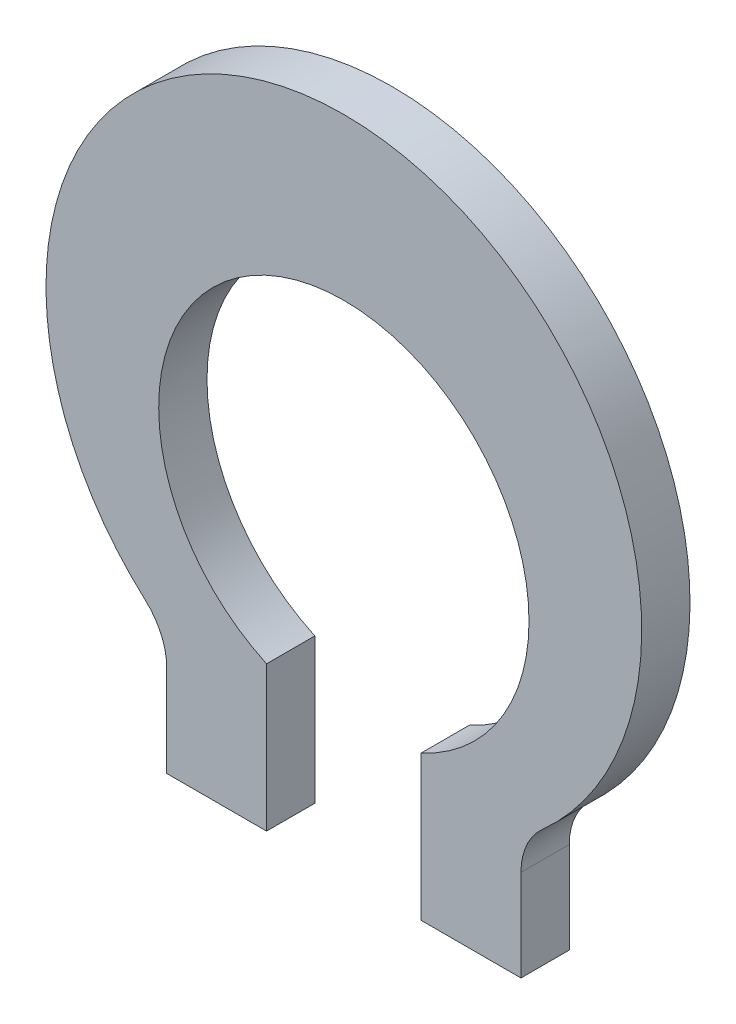
from build123d import *

# Parameters (mm, degrees)
BOSS_EXTRUDE1_DEPTH = 1.5
FILLET1_R           = 2


with BuildPart() as part:
    # Sketch1 → Boss-Extrude1 (new body)
    with BuildSketch(Plane.XY):
        with BuildLine():
            ThreePointArc((2.4, 4.5), (0, 15.475179423), (-2.4, 4.5))
            Line((-2.4, 4.5), (-2.4, 0))
            Line((-2.4, 0), (-5.5, 0))
            Line((-5.5, 0), (-5.5, 3.787942032))
            ThreePointArc((-5.5, 3.787942032), (0, 20.475179423), (5.5, 3.787942032))
            Line((5.5, 3.787942032), (5.5, 0))
            Line((5.5, 0), (2.4, 0))
            Line((2.4, 0), (2.4, 4.5))
        make_face()
    extrude(amount=BOSS_EXTRUDE1_DEPTH)

    # Fillet1
    fillet1_edges = [part.edges().sort_by_distance(p)[0] for p in [
        (-5.5, 3.787942032, 0.75),
        (5.5, 3.787942032, 0.75),
    ]]
    fillet(fillet1_edges, radius=FILLET1_R)


solid = part.part
